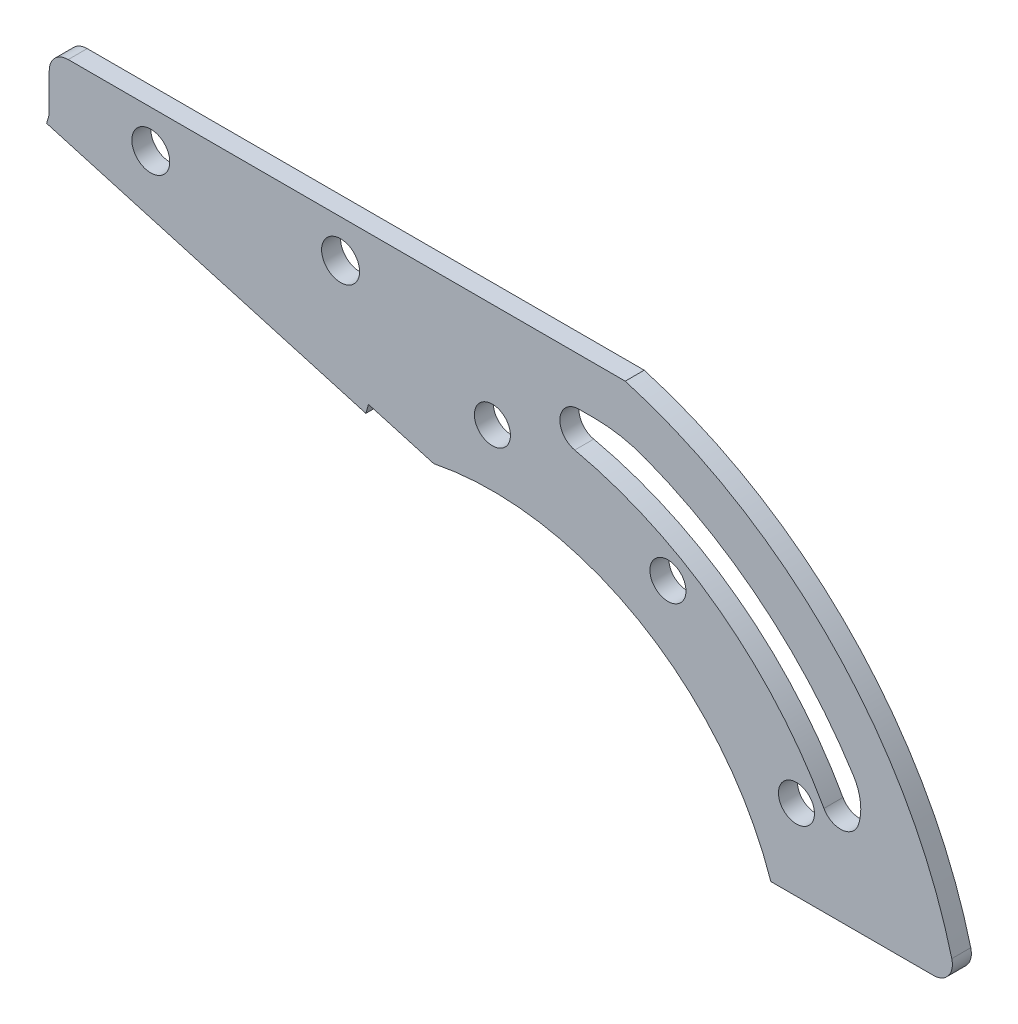
from build123d import *

# Parameters (mm, degrees)
SKETCH_1_W          = 128.43547374
SKETCH_1_H          = 65.471989544
EXTRUDE_1_DEPTH     = 2
SKETCH_2_W          = 128.43547374
SKETCH_2_H          = 65.471989544
CUT_EXTRUDE_1_DEPTH = 2
SKETCH_3_R          = 2
SKETCH_3_R_2        = 1.9
CUT_EXTRUDE_2_DEPTH = 2


with BuildPart() as part:
    # 草图1 → 凸台-拉伸1 (new body)
    with BuildSketch(Plane.XY):
        Rectangle(SKETCH_1_W, SKETCH_1_H)
    extrude(amount=EXTRUDE_1_DEPTH)

    # 草图2 → 切除-拉伸1 (cut)
    # profile 1 of 2: a face of its own
    with BuildSketch(Plane(origin=(0, 0, 0), x_dir=(-1, 0, 0), z_dir=(0, 0, -1))):
        Rectangle(SKETCH_2_W, SKETCH_2_H)
        with BuildLine():
            Line((9.542331638, 3.44740736), (9.266694282, 4.408669056))
            Line((9.266694282, 4.408669056), (2.382968092, 2.434792334))
            ThreePointArc((2.382968092, 2.434792334), (-19.219474678, -1.055618469), (-33.134584344, -17.944023491))
            Line((-33.134584344, -17.944023491), (-50.267582996, -17.944023491))
            ThreePointArc((-50.267582996, -17.944023491), (-51.848721826, -17.168768362), (-52.204074669, -15.444023491))
            ThreePointArc((-52.204074669, -15.444023491), (-39.692841918, 6.857039096), (-17.791782842, 20.055976509))
            Line((-17.791782842, 20.055976509), (40.91085364, 20.055976509))
            ThreePointArc((40.91085364, 20.055976509), (42.325067202, 19.470190071), (42.91085364, 18.055976509))
            Line((42.91085364, 18.055976509), (42.91085364, 14.055976509))
            Line((42.91085364, 14.055976509), (43.186490996, 13.094714813))
            Line((43.186490996, 13.094714813), (9.542331638, 3.44740736))
        make_face(mode=Mode.SUBTRACT)
    # profile 2 of 2: a face of its own
    with BuildSketch(Plane(origin=(0, 0, 0), x_dir=(-1, 0, 0), z_dir=(0, 0, -1))):
        with BuildLine():
            ThreePointArc((-12.46838625, 11.103595557), (-10.914156826, 13.274194399), (-12.902216421, 15.055976509))
            Line((-12.902216421, 15.055976509), (-14.562112456, 15.055976509))
            ThreePointArc((-14.562112456, 15.055976509), (-17.300725243, 14.803857713), (-19.947277263, 14.055976509))
            ThreePointArc((-19.947277263, 14.055976509), (-32.344819708, 6.837064556), (-41.840361935, -3.916838284))
            ThreePointArc((-41.840361935, -3.916838284), (-42.583463702, -6.046223655), (-42.315225959, -8.285538463))
            ThreePointArc((-42.315225959, -8.285538463), (-40.580263178, -9.493037777), (-38.730856221, -8.469395089))
            ThreePointArc((-38.730856221, -8.469395089), (-27.694864361, 4.128436562), (-12.46838625, 11.103595557))
        make_face()
    extrude(amount=-CUT_EXTRUDE_1_DEPTH, mode=Mode.SUBTRACT)

    # 草图3 → 切除-拉伸2 (cut)
    with BuildSketch(Plane(origin=(0, 0, 0), x_dir=(-1, 0, 0), z_dir=(0, 0, -1))):
        with Locations((32.208217158, 16.055976509)):
            Circle(SKETCH_3_R)
        with Locations((12.208217158, 16.055976509)):
            Circle(SKETCH_3_R)
        with Locations((-3.791782842, 9.055976509)):
            Circle(SKETCH_3_R_2)
        with Locations((-35.834722782, -9.444023491)):
            Circle(SKETCH_3_R_2)
        with Locations((-22.291782842, 4.098916449)):
            Circle(SKETCH_3_R_2)
    extrude(amount=-CUT_EXTRUDE_2_DEPTH, mode=Mode.SUBTRACT)


solid = part.part
